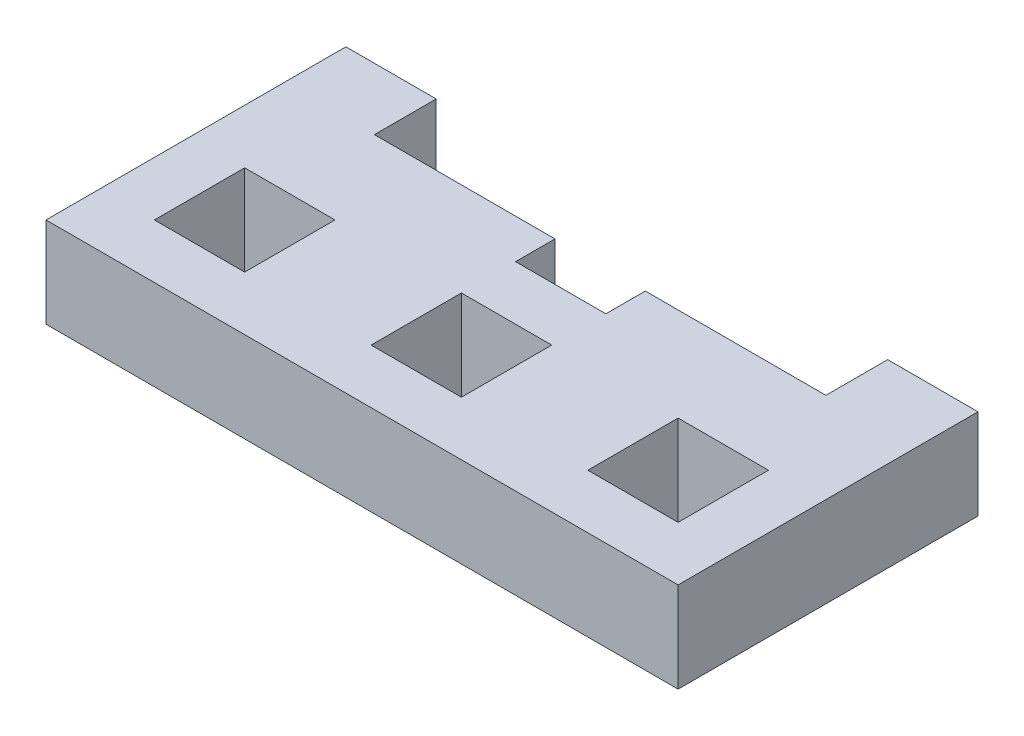
from build123d import *

# Parameters (mm, degrees)
SKETCH1_W           = 6.35
SKETCH1_H           = 6.35
BOSS_EXTRUDE1_DEPTH = 6.35


with BuildPart() as part:
    # Sketch1 → Boss-Extrude1 (new body)
    with BuildSketch(Plane(origin=(0, 0, 0), x_dir=(1, 0, 0), z_dir=(0, 1, 0))):
        Polygon((-22.225, -6.985), (22.225, -6.985), (22.225, 9.757500043), (22.225, 14.102499989), (15.875, 14.102499989), (15.875, 9.757500043), (3.175, 9.757500043), (3.175, 6.985), (-3.175, 6.985), (-3.175, 9.757500043), (-15.875, 9.757500043), (-15.875, 14.102499989), (-22.225, 14.102499989), (-22.225, 9.757500043), align=None)
        Rectangle(SKETCH1_W, SKETCH1_H, mode=Mode.SUBTRACT)
        with Locations((15.24, 0)):
            Rectangle(SKETCH1_W, SKETCH1_H, mode=Mode.SUBTRACT)
        with Locations((-15.24, 0)):
            Rectangle(SKETCH1_W, SKETCH1_H, mode=Mode.SUBTRACT)
    extrude(amount=BOSS_EXTRUDE1_DEPTH)


solid = part.part
